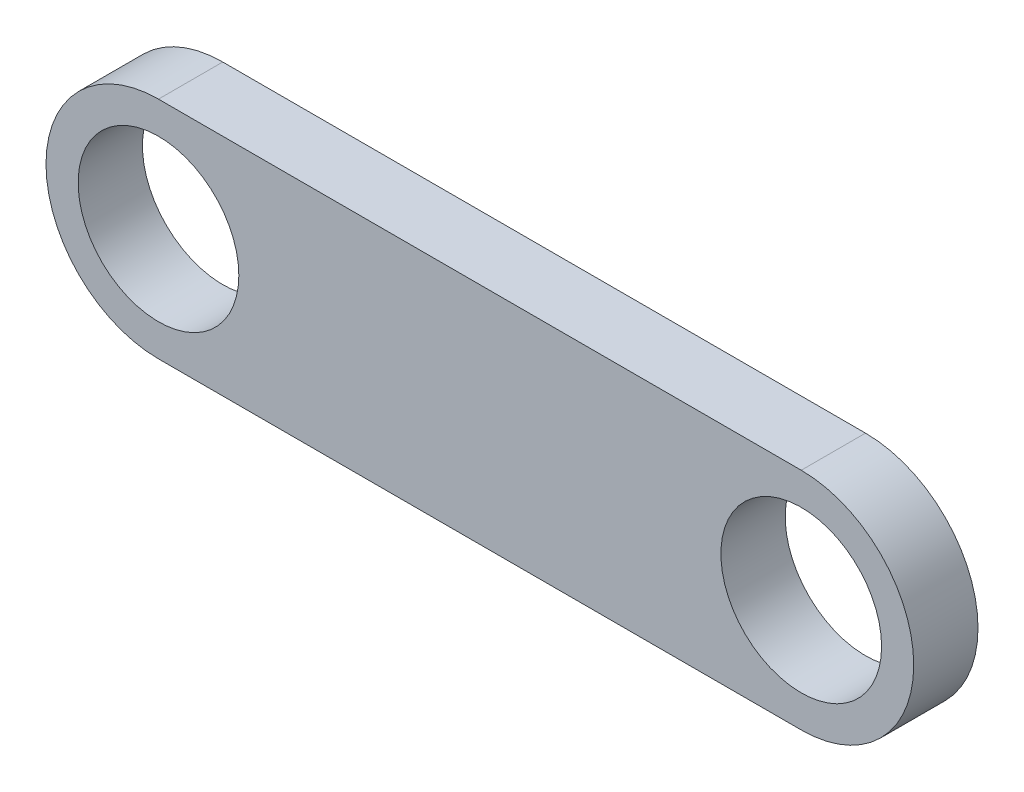
from build123d import *

# Parameters (mm, degrees)
SKETCH_1_R      = 25
EXTRUDE_1_DEPTH = 20


with BuildPart() as part:
    # Эскиз1 → Бобышка-Вытянуть1 (new body)
    with BuildSketch(Plane.XY):
        with BuildLine():
            Line((0, 35), (200, 35))
            ThreePointArc((200, 35), (235, 0), (200, -35))
            Line((200, -35), (0, -35))
            ThreePointArc((0, -35), (-35, 0), (0, 35))
        make_face()
        Circle(SKETCH_1_R, mode=Mode.SUBTRACT)
        with Locations((200, 0)):
            Circle(SKETCH_1_R, mode=Mode.SUBTRACT)
    extrude(amount=EXTRUDE_1_DEPTH)


solid = part.part
